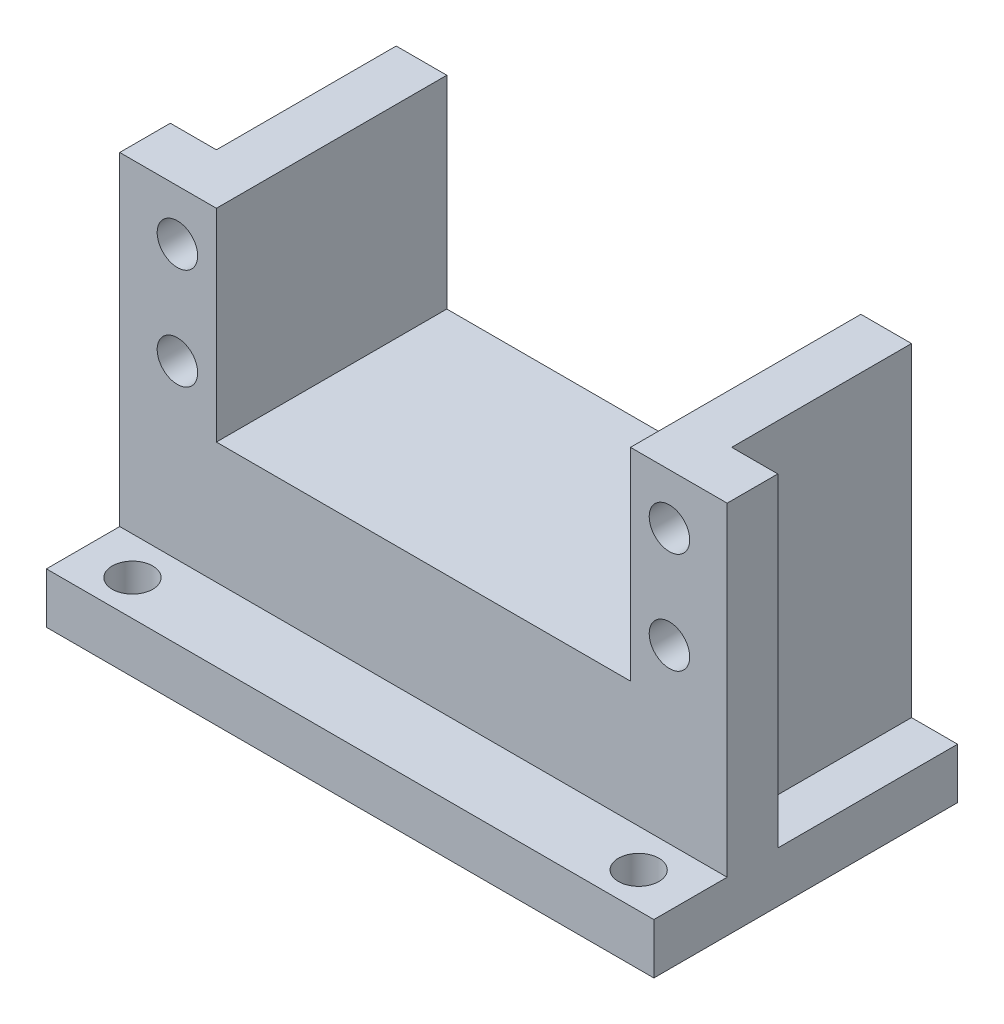
from build123d import *

# Parameters (mm, degrees)
SKETCH1_W           = 60
SKETCH1_H           = 30
BOSS_EXTRUDE1_DEPTH = 5
BOSS_EXTRUDE4_DEPTH = 32
SKETCH7_W           = 40.9
SKETCH7_H           = 22.76
BOSS_EXTRUDE5_DEPTH = 12
SKETCH9_R           = 2
CUT_EXTRUDE2_DEPTH  = 5
SKETCH10_R          = 2
CUT_EXTRUDE3_DEPTH  = 4


with BuildPart() as part:
    # Sketch1 → Boss-Extrude1 (new body)
    with BuildSketch(Plane(origin=(0, 0, 0), x_dir=(1, 0, 0), z_dir=(0, 1, 0))):
        Rectangle(SKETCH1_W, SKETCH1_H)
    extrude(amount=BOSS_EXTRUDE1_DEPTH)

    # Sketch6 → Boss-Extrude4 (add)
    with BuildSketch(Plane(origin=(0, 5, 0), x_dir=(1, 0, 0), z_dir=(0, 1, 0))):
        Polygon((-20.45, 15), (-25.45, 15), (-25.45, -2.76), (-30, -2.76), (-30, -7.76), (-20.45, -7.76), align=None)
        Polygon((30, -2.76), (30, -7.76), (20.45, -7.76), (20.45, 15), (25.45, 15), (25.45, -2.76), align=None)
    extrude(amount=BOSS_EXTRUDE4_DEPTH)

    # Sketch7 → Boss-Extrude5 (add)
    with BuildSketch(Plane(origin=(0, 5, 0), x_dir=(1, 0, 0), z_dir=(0, 1, 0))):
        with Locations((0, 3.62)):
            Rectangle(SKETCH7_W, SKETCH7_H)
    extrude(amount=BOSS_EXTRUDE5_DEPTH)

    # Sketch9 → Cut-Extrude2 (cut)
    with BuildSketch(Plane(origin=(0, 5, 0), x_dir=(1, 0, 0), z_dir=(0, 1, 0))):
        with Locations(Location((-25, -11.5, 0), (0, 0, 270))):
            Circle(SKETCH9_R)
        with Locations(Location((25, -11.5, 0), (0, 0, 270))):
            Circle(SKETCH9_R)
    extrude(amount=-CUT_EXTRUDE2_DEPTH, mode=Mode.SUBTRACT)

    # Sketch10 → Cut-Extrude3 (cut)
    with BuildSketch(Plane.XY.offset(7.76)):
        with Locations((-24.3, 32)):
            Circle(SKETCH10_R)
        with Locations((-24.3, 22)):
            Circle(SKETCH10_R)
        with Locations(Location((24.3, 22, 0), (0, 0, 180))):
            Circle(SKETCH10_R)
        with Locations(Location((24.3, 32, 0), (0, 0, 180))):
            Circle(SKETCH10_R)
    extrude(amount=-CUT_EXTRUDE3_DEPTH, mode=Mode.SUBTRACT)


solid = part.part
